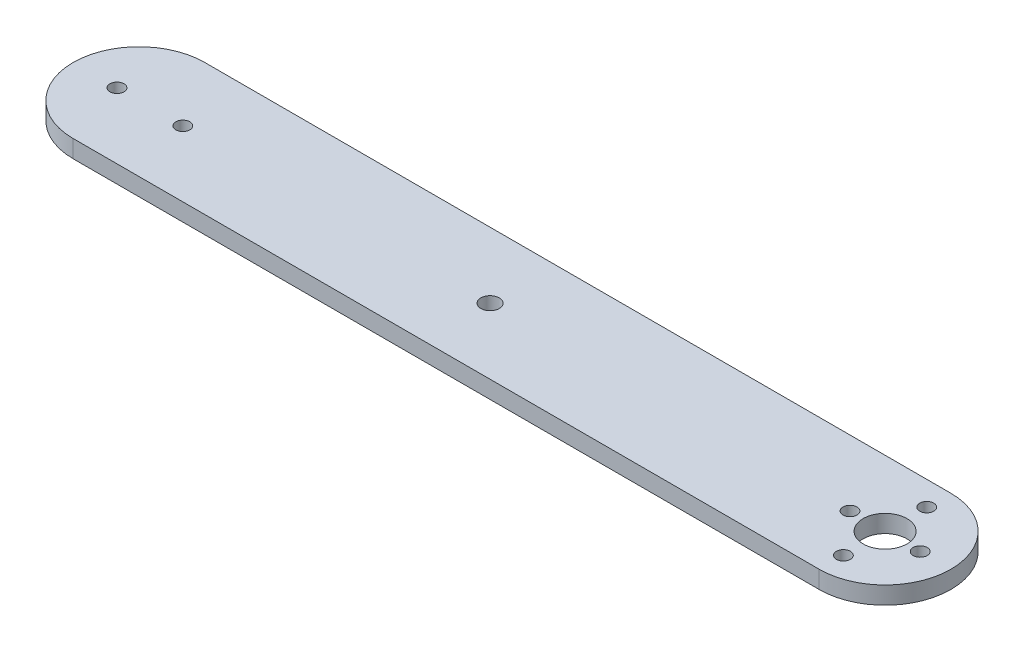
from build123d import *

# Parameters (mm, degrees)
SKETCH2_R           = 5
SKETCH2_R_2         = 1.6
BOSS_EXTRUDE1_DEPTH = 4
SKETCH3_R           = 2.1
CUT_EXTRUDE1_DEPTH  = 186.650208726


with BuildPart() as part:
    # Sketch2 → Boss-Extrude1 (new body)
    with BuildSketch(Plane(origin=(0, 0, 0), x_dir=(1, 0, 0), z_dir=(0, 1, 0))):
        with BuildLine():
            Line((0, -15), (-170, -15))
            ThreePointArc((-170, -15), (-185, 0), (-170, 15))
            Line((-170, 15), (0, 15))
            ThreePointArc((0, 15), (15, 0), (0, -15))
        make_face()
        Circle(SKETCH2_R, mode=Mode.SUBTRACT)
        with Locations((8, 0)):
            Circle(SKETCH2_R_2, mode=Mode.SUBTRACT)
        with Locations((-160, 0)):
            Circle(SKETCH2_R_2, mode=Mode.SUBTRACT)
        with Locations((-175, 0)):
            Circle(SKETCH2_R_2, mode=Mode.SUBTRACT)
        with Locations((0, -9.5)):
            Circle(SKETCH2_R_2, mode=Mode.SUBTRACT)
        with Locations((0, 9.5)):
            Circle(SKETCH2_R_2, mode=Mode.SUBTRACT)
        with Locations((-8, 0)):
            Circle(SKETCH2_R_2, mode=Mode.SUBTRACT)
    extrude(amount=BOSS_EXTRUDE1_DEPTH)

    # Sketch3 → Cut-Extrude1 (cut, through all)
    with BuildSketch(Plane(origin=(0, 4, 0), x_dir=(1, 0, 0), z_dir=(0, 1, 0))):
        with Locations((-90, 0)):
            Circle(SKETCH3_R)
    extrude(amount=-CUT_EXTRUDE1_DEPTH, mode=Mode.SUBTRACT)


solid = part.part
